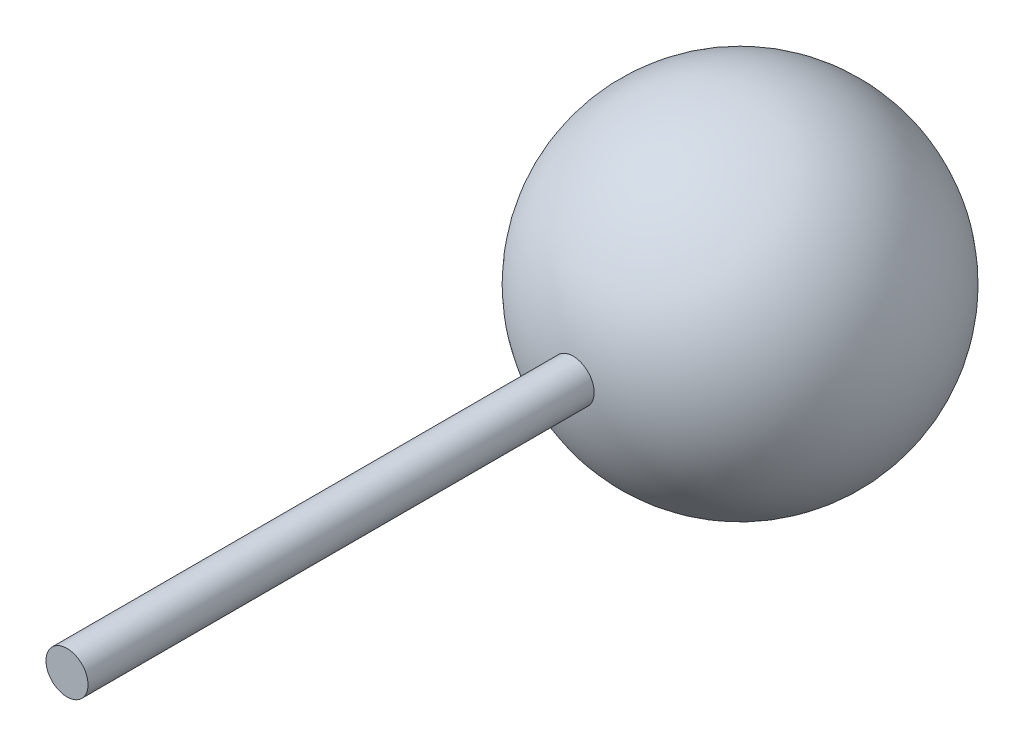
from build123d import *

# Parameters (mm, degrees)
SKETCH2_R           = 0.79375
BOSS_EXTRUDE1_DEPTH = 25.4


with BuildPart() as part:
    # Sketch1 → Revolve1 (revolve)
    with BuildSketch(Plane(origin=(0, 0, 0), x_dir=(1, 0, 0), z_dir=(0, 1, 0))):
        with BuildLine():
            Line((0, 6.35), (0, -6.35))
            ThreePointArc((0, -6.35), (6.35, 0), (0, 6.35))
        make_face()
    revolve(axis=Axis((0, 0, -6.35), (0, 0, 1)))

    # Sketch2 → Boss-Extrude1 (add)
    with BuildSketch(Plane.XY):
        Circle(SKETCH2_R)
    extrude(amount=BOSS_EXTRUDE1_DEPTH)


solid = part.part
